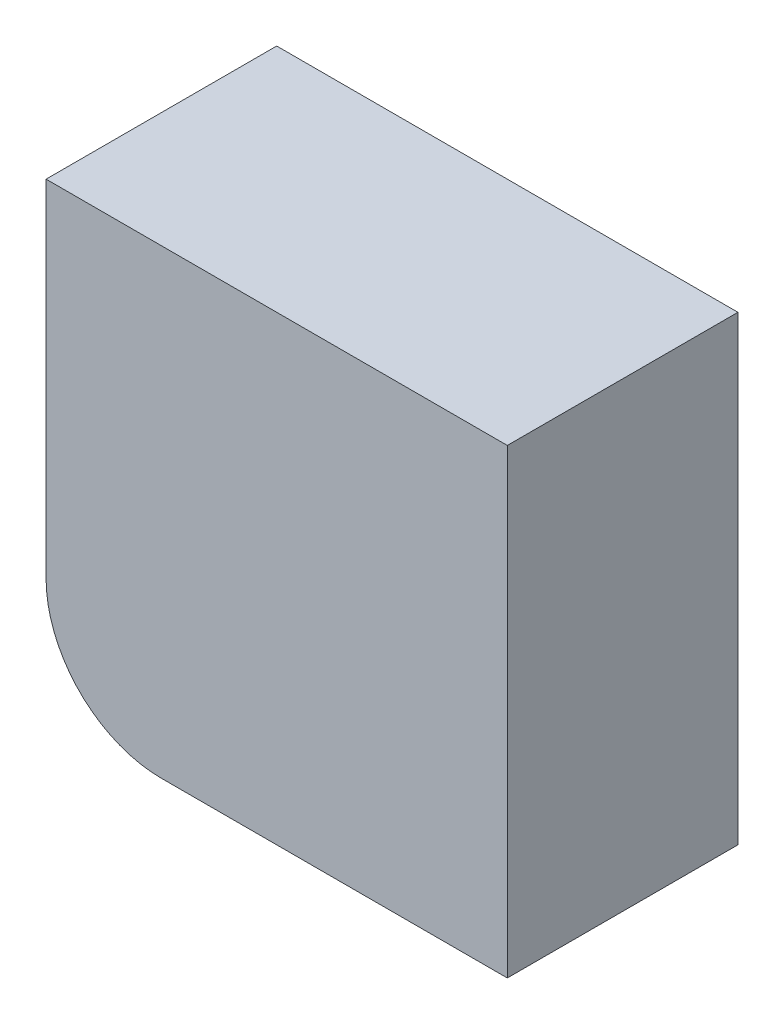
from build123d import *

# Parameters (mm, degrees)
SKETCH_1_W    = 20
SKETCH_1_H    = 20
BASEBOX_DEPTH = 10
FILLET_2_R    = 5


with BuildPart() as part:
    # 草图1 → BaseBox (new body)
    with BuildSketch(Plane.XY):
        with Locations((10, 10)):
            Rectangle(SKETCH_1_W, SKETCH_1_H)
    extrude(amount=BASEBOX_DEPTH)

    # Fillet 2
    fillet_2_edges = [part.edges().sort_by_distance(p)[0] for p in [
        (0, 0, 5),
    ]]
    fillet(fillet_2_edges, radius=FILLET_2_R)


solid = part.part
